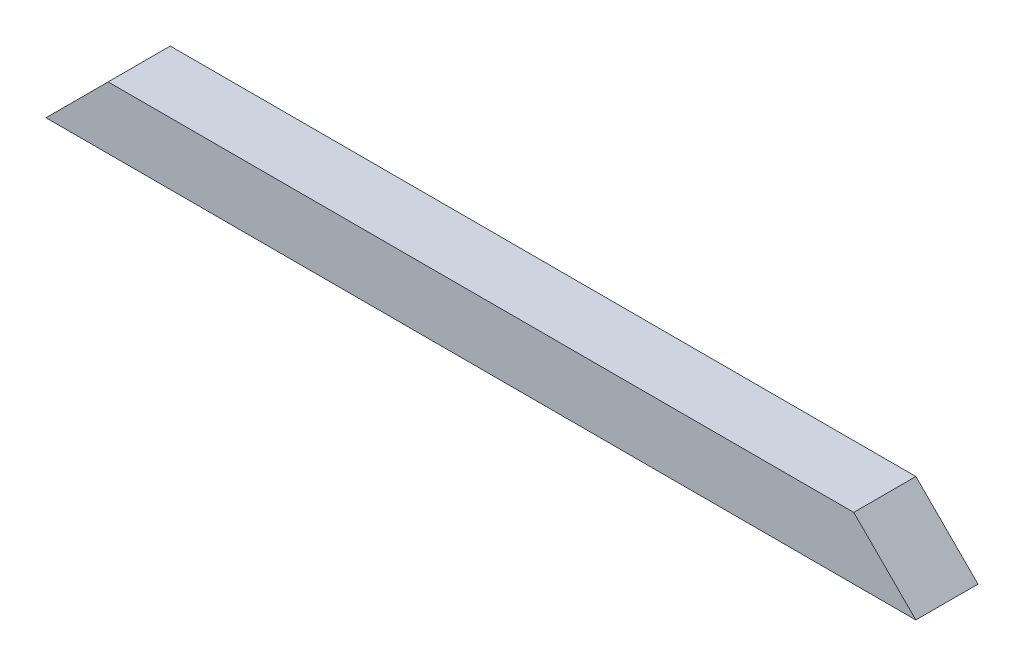
from build123d import *

# Parameters (mm, degrees)
CROQUIS1_W              = 711.2
CROQUIS1_H              = 50.8
SALIENTE_EXTRUIR1_DEPTH = 50.8
CORTAR_EXTRUIR1_DEPTH   = 361.10715072
CORTAR_EXTRUIR2_DEPTH   = 361.10715072


with BuildPart() as part:
    # Croquis1 → Saliente-Extruir1 (new body)
    with BuildSketch(Plane.XY):
        Rectangle(CROQUIS1_W, CROQUIS1_H)
    extrude(amount=SALIENTE_EXTRUIR1_DEPTH)

    # Croquis2 → Cortar-Extruir1 (cut, through all)
    with BuildSketch(Plane.XY.offset(50.8)):
        Polygon((355.6, 25.4), (335.6, 25.4), (355.6, -25.4), align=None)
        Polygon((-335.6, 25.4), (-355.6, 25.4), (-355.6, -25.4), align=None)
    extrude(amount=-CORTAR_EXTRUIR1_DEPTH, mode=Mode.SUBTRACT)

    # Croquis3 → Cortar-Extruir2 (cut, through all)
    with BuildSketch(Plane.XY.offset(50.8)):
        Polygon((-335.6, 25.4), (-355.6, -25.4), (-304.8, 25.4), align=None)
        Polygon((335.6, 25.4), (304.8, 25.4), (355.6, -25.4), align=None)
    extrude(amount=-CORTAR_EXTRUIR2_DEPTH, mode=Mode.SUBTRACT)


solid = part.part
